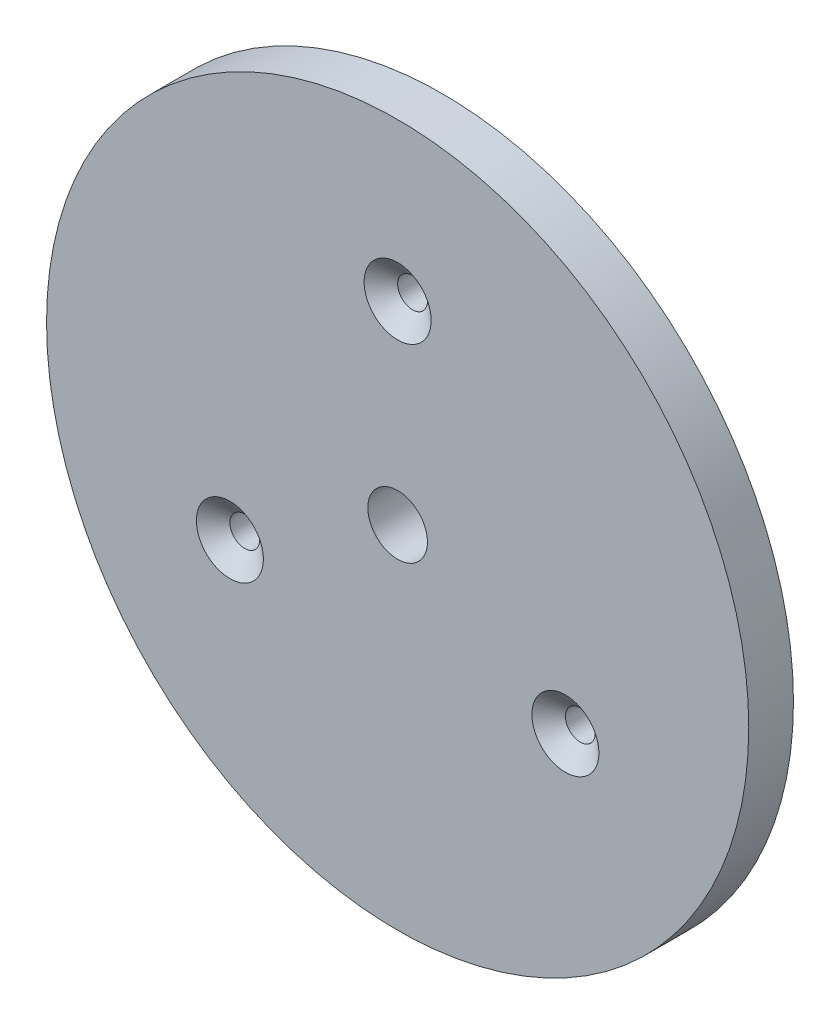
from build123d import *

# Parameters (mm, degrees)
SKETCH3_R           = 47.125
SKETCH3_R_2         = 4
SKETCH3_R_3         = 2
BOSS_EXTRUDE1_DEPTH = 6
CHAMFER1_SIZE       = 2.5
CHAMFER1_SIZE2      = 2


with BuildPart() as part:
    # Sketch3 → Boss-Extrude1 (new body)
    with BuildSketch(Plane(origin=(0, 0, 0), x_dir=(0, 1, 0), z_dir=(0, 0, 1))):
        with Locations(Location((0, 0, 0), (0, 0, 270))):
            Circle(SKETCH3_R)
        with Locations(Location((0, 0, 0), (0, 0, 270))):
            Circle(SKETCH3_R_2, mode=Mode.SUBTRACT)
        with Locations(Location((26, 0, 0), (0, 0, 270))):
            Circle(SKETCH3_R_3, mode=Mode.SUBTRACT)
        with Locations(Location((-13, -22.516660498, 0), (0, 0, 270))):
            Circle(SKETCH3_R_3, mode=Mode.SUBTRACT)
        with Locations(Location((-13, 22.516660498, 0), (0, 0, 270))):
            Circle(SKETCH3_R_3, mode=Mode.SUBTRACT)
    extrude(amount=BOSS_EXTRUDE1_DEPTH)

    # Chamfer1
    chamfer1_edges = [part.edges().sort_by_distance(p)[0] for p in [
        (20.516660498, -13, 6),
        (-24.516660498, -13, 6),
        (-2, 26, 6),
    ]]
    chamfer1_side = [part.faces().sort_by_distance(p)[0] for p in [
        (-45.792103717, 0, 6),
    ]]
    chamfer(chamfer1_edges, length=CHAMFER1_SIZE, length2=CHAMFER1_SIZE2, reference=chamfer1_side[0])


solid = part.part
